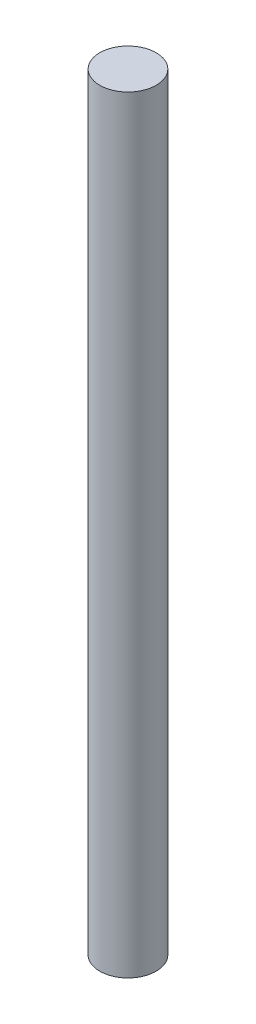
from build123d import *

# Parameters (mm, degrees)
SKETCH1_W          = 7.5
SKETCH1_H          = 204
SKETCH2_W          = 3
SKETCH2_H          = 3
CUT_EXTRUDE1_DEPTH = 18
SKETCH3_W          = 3
SKETCH3_H          = 3
CUT_EXTRUDE2_DEPTH = 15


with BuildPart() as part:
    # Sketch1 → Revolve1 (revolve)
    with BuildSketch(Plane.XY, mode=Mode.PRIVATE) as revolve1_sk:
        with Locations((3.75, 102)):
            Rectangle(SKETCH1_W, SKETCH1_H)
    revolve(revolve1_sk.sketch.rotate(Axis((0, 204, 0), (0, -1, 0)), 180), axis=Axis((0, 204, 0), (0, -1, 0)))

    # Sketch2 → Cut-Extrude1 (cut)
    with BuildSketch(Plane(origin=(0, 187, 0), x_dir=(1, 0, 0), z_dir=(0, 1, 0))):
        with Locations((0, 7.5)):
            Rectangle(SKETCH2_W, SKETCH2_H)
    extrude(amount=-CUT_EXTRUDE1_DEPTH, mode=Mode.SUBTRACT)

    # Sketch3 → Cut-Extrude2 (cut)
    with BuildSketch(Plane(origin=(0, 104, 0), x_dir=(-1, 0, 0), z_dir=(0, -1, 0))):
        with Locations((0, 7.5)):
            Rectangle(SKETCH3_W, SKETCH3_H)
    extrude(amount=CUT_EXTRUDE2_DEPTH, mode=Mode.SUBTRACT)


solid = part.part
